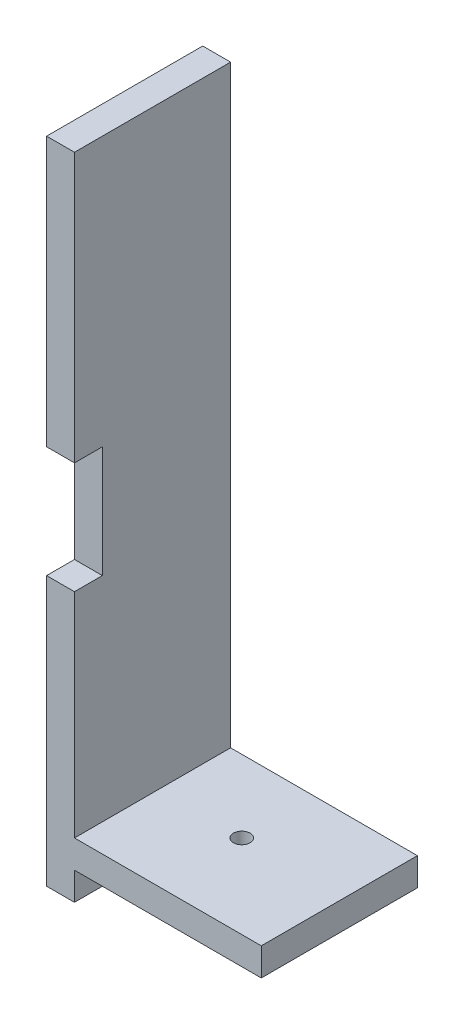
from build123d import *

# Parameters (mm, degrees)
EXTRUDE_1_DEPTH     = 28
SKETCH_2_W          = 5
SKETCH_2_H          = 20
CUT_EXTRUDE_1_DEPTH = 5
SKETCH_3_R          = 1.5
CUT_EXTRUDE_2_DEPTH = 118.133742985


with BuildPart() as part:
    # 草圖1 → 填料-伸長1 (new body)
    with BuildSketch(Plane.XY):
        Polygon((-17.451364004, -6.196122823), (-17.451364004, -11.196122823), (-22.451364004, -11.196122823), (-22.451364004, 105.303877177), (-17.451364004, 105.303877177), (-17.451364004, 100.303877177), (-17.451364004, 95.303877177), (-17.451364004, -1.196122823), (16.048635996, -1.196122823), (16.048635996, -6.196122823), align=None)
    extrude(amount=EXTRUDE_1_DEPTH)

    # 草圖2 → 除料-伸長1 (cut)
    with BuildSketch(Plane(origin=(0, 0, 28), x_dir=(-1, 0, 0), z_dir=(0, 0, -1))):
        with Locations((19.951364004, 47.053877177)):
            Rectangle(SKETCH_2_W, SKETCH_2_H)
    extrude(amount=CUT_EXTRUDE_1_DEPTH, mode=Mode.SUBTRACT)

    # 草圖3 → 除料-伸長2 (cut, through all)
    with BuildSketch(Plane.XZ.offset(6.196122823)):
        with Locations((-2.451364004, 13)):
            Circle(SKETCH_3_R)
    extrude(amount=-CUT_EXTRUDE_2_DEPTH, mode=Mode.SUBTRACT)


solid = part.part
